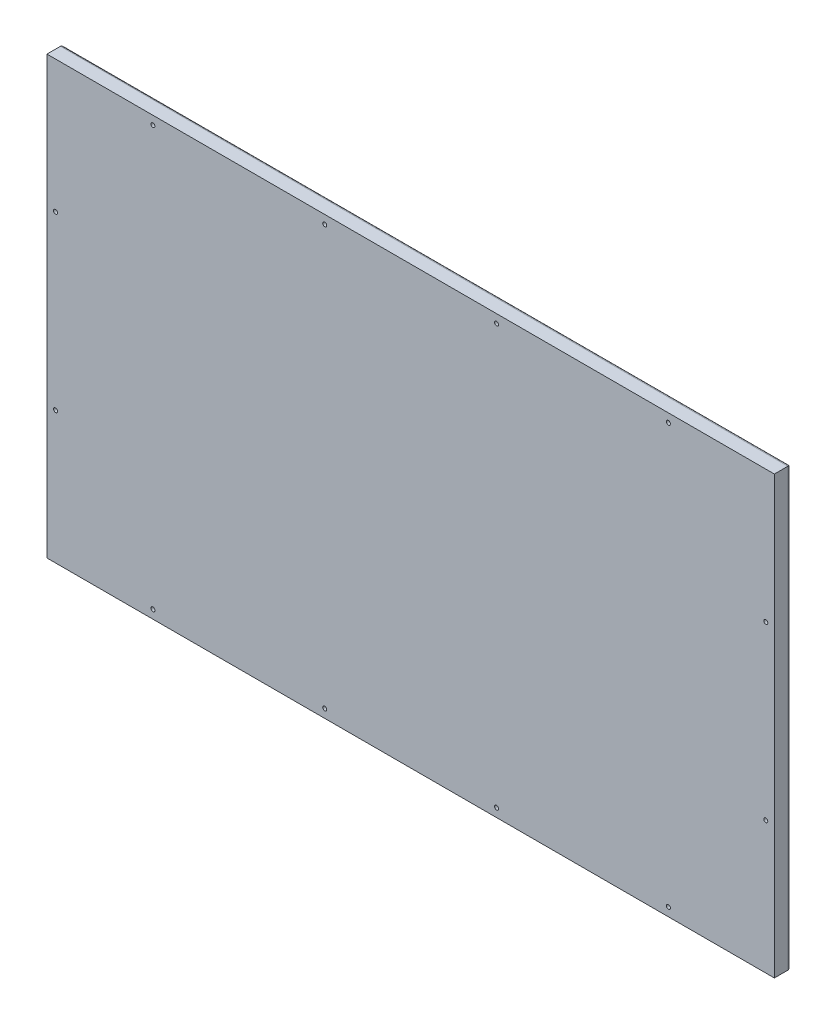
from build123d import *

# Parameters (mm, degrees)
SKETCH1_W                      = 1270
SKETCH1_H                      = 762
BOSS_EXTRUDE1_DEPTH            = 28.575
CBORE_FOR_M6_SHCS1_D           = 7
CBORE_FOR_M6_SHCS1_CBORE_D     = 11
CBORE_FOR_M6_SHCS1_CBORE_DEPTH = 9.5
FILLET1_R                      = 5


with BuildPart() as part:
    # Sketch1 → Boss-Extrude1 (new body)
    with BuildSketch(Plane.XY):
        Rectangle(SKETCH1_W, SKETCH1_H)
    extrude(amount=BOSS_EXTRUDE1_DEPTH)

    # CBORE for M6 SHCS1 (through all)
    with Locations(Plane(origin=(0, 0, 0), x_dir=(1, 0, 0), z_dir=(0, 0, -1))):
        with Locations((-150, -366), (150, -366), (620, -150), (620, 150), (150, 366), (-150, 366), (-620, 150), (-620, -150), (-450, -366), (450, -366), (450, 366), (-450, 366)):
            CounterBoreHole(CBORE_FOR_M6_SHCS1_D / 2, CBORE_FOR_M6_SHCS1_CBORE_D / 2, CBORE_FOR_M6_SHCS1_CBORE_DEPTH)

    # Fillet1
    fillet1_edges = [part.edges().sort_by_distance(p)[0] for p in [
        (0, -381, 0),
        (-635, 0, 0),
        (0, 381, 0),
        (635, 0, 0),
    ]]
    fillet(fillet1_edges, radius=FILLET1_R)


solid = part.part
